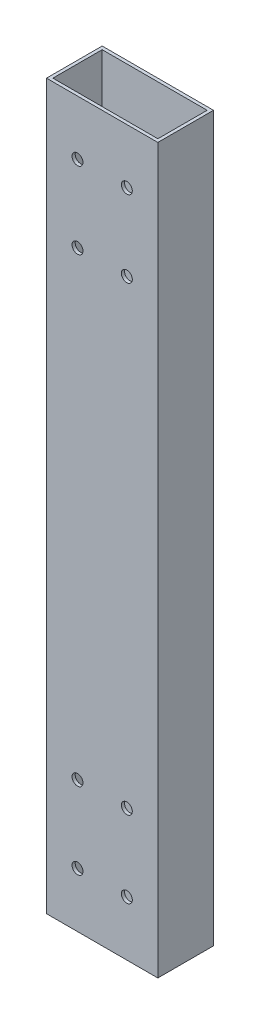
from build123d import *

# Parameters (mm, degrees)
SKETCH1_W           = 50.8
SKETCH1_H           = 25.4
SKETCH1_W_2         = 47.9
SKETCH1_H_2         = 22.5
BOSS_EXTRUDE1_DEPTH = 330.2
SKETCH2_R           = 2.5
CUT_EXTRUDE1_DEPTH  = 333.148099498


with BuildPart() as part:
    # Sketch1 → Boss-Extrude1 (new body)
    with BuildSketch(Plane(origin=(0, 0, 0), x_dir=(1, 0, 0), z_dir=(0, 1, 0))):
        Rectangle(SKETCH1_W, SKETCH1_H)
        Rectangle(SKETCH1_W_2, SKETCH1_H_2, mode=Mode.SUBTRACT)
    extrude(amount=BOSS_EXTRUDE1_DEPTH)

    # Sketch2 → Cut-Extrude1 (cut, through all)
    with BuildSketch(Plane.XY.offset(12.7)):
        with Locations((-11.25, 60)):
            Circle(SKETCH2_R)
        with Locations((-11.25, 25)):
            Circle(SKETCH2_R)
        with Locations((11.25, 25)):
            Circle(SKETCH2_R)
        with Locations((11.25, 60)):
            Circle(SKETCH2_R)
    cut_extrude1 = extrude(amount=-CUT_EXTRUDE1_DEPTH, mode=Mode.SUBTRACT)

    # Mirror1: Cut-Extrude1 across plane
    add(cut_extrude1.mirror(Plane.ZX.offset(165.1)), mode=Mode.SUBTRACT)


solid = part.part
